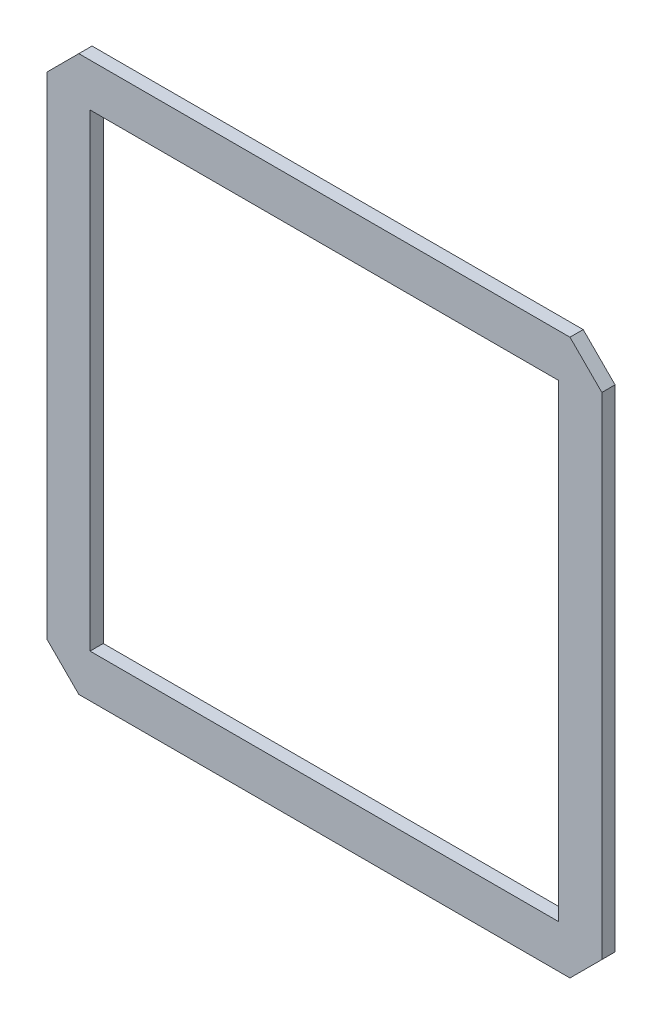
from build123d import *

# Parameters (mm, degrees)
SKETCH1_W           = 106.411119242
SKETCH1_H           = 106.411119242
BOSS_EXTRUDE1_DEPTH = 3


with BuildPart() as part:
    # Sketch1 → Boss-Extrude1 (new body)
    with BuildSketch(Plane.XY):
        Polygon((256.757359313, 297), (145.242640687, 297), (138, 289.757359313), (138, 178.242640687), (145.242640687, 171), (256.757359313, 171), (264, 178.242640687), (264, 289.757359313), align=None)
        with Locations((201, 234)):
            Rectangle(SKETCH1_W, SKETCH1_H, mode=Mode.SUBTRACT)
    extrude(amount=BOSS_EXTRUDE1_DEPTH)


solid = part.part
